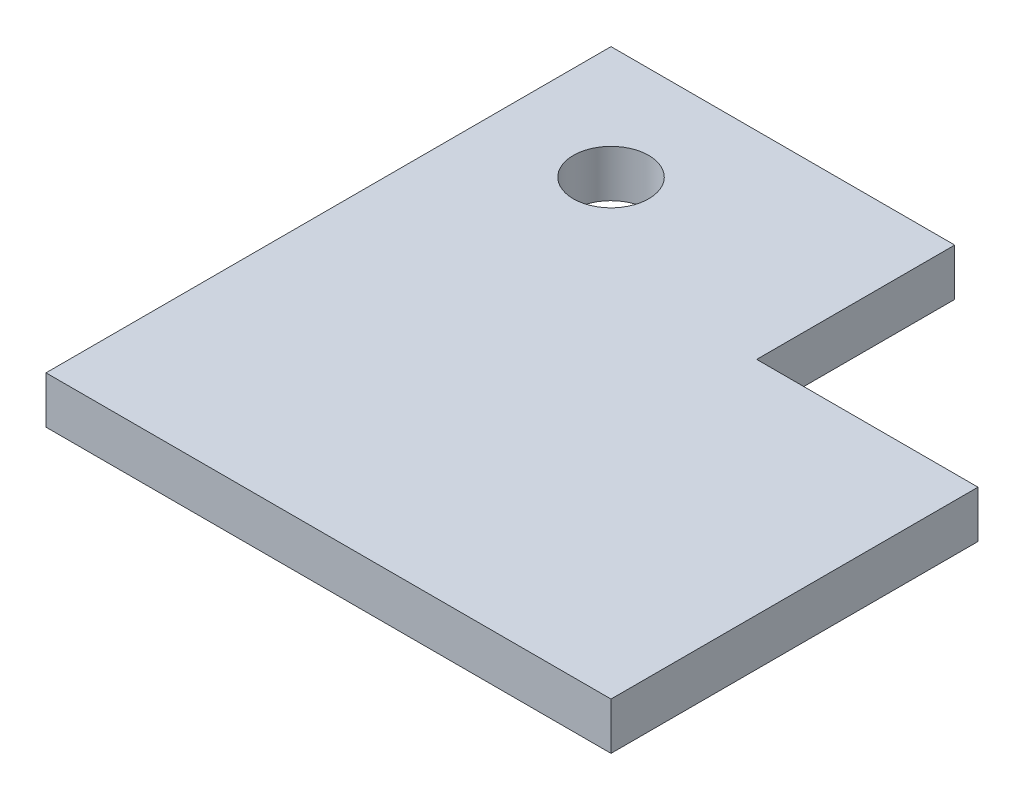
from build123d import *

# Parameters (mm, degrees)
SKETCH_1_W          = 60
SKETCH_1_H          = 60
SKETCH_1_R          = 4
EXTRUDE_1_DEPTH     = 5
SKETCH_2_W          = 23.5
SKETCH_2_H          = 21.03
CUT_EXTRUDE_1_DEPTH = 86


with BuildPart() as part:
    # 草图1 → 凸台-拉伸1 (new body)
    with BuildSketch(Plane(origin=(0, 0, 0), x_dir=(1, 0, 0), z_dir=(0, 1, 0))):
        with Locations((30, -30)):
            Rectangle(SKETCH_1_W, SKETCH_1_H)
        with Locations(Location((12, -12, 0), (0, 0, 270))):
            Circle(SKETCH_1_R, mode=Mode.SUBTRACT)
    extrude(amount=EXTRUDE_1_DEPTH)

    # 草图2 → 切除-拉伸1 (cut, through all)
    with BuildSketch(Plane(origin=(0, 0, 0), x_dir=(1, 0, 0), z_dir=(0, 1, 0))):
        with Locations((48.25, -10.515)):
            Rectangle(SKETCH_2_W, SKETCH_2_H)
    extrude(amount=CUT_EXTRUDE_1_DEPTH, mode=Mode.SUBTRACT)


solid = part.part
